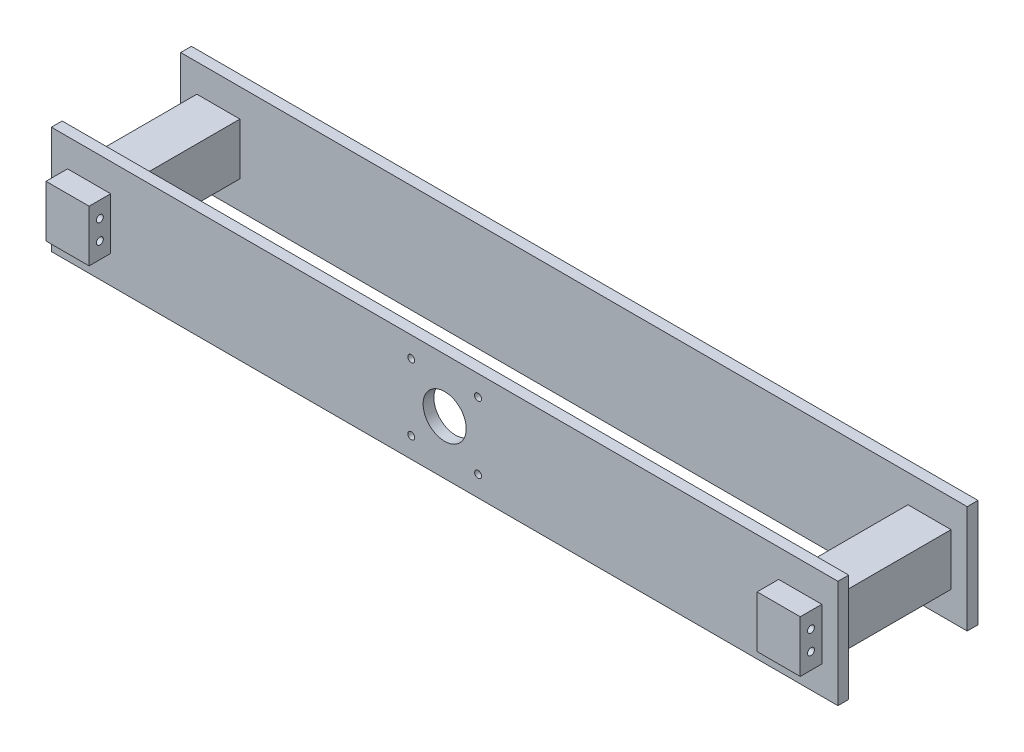
from build123d import *

# Parameters (mm, degrees)
SKETCH_1_W             = 365
SKETCH_1_H             = 50
EXTRUDE_1_DEPTH        = 2.5
SKETCH_2_W             = 20
SKETCH_2_H             = 24
EXTRUDE_2_DEPTH        = 70
PATTERN_LINEAR_1_COUNT = 2
PATTERN_LINEAR_1_PITCH = 60
SKETCH_4_R             = 1.6
CUT_EXTRUDE_1_DEPTH    = 366.633012733
CUT_EXTRUDE_2_REACH    = 197.336
SKETCH_5_R             = 1.6
SKETCH_5_R_2           = 10


with BuildPart() as part:
    # 草图1 → 凸台-拉伸1 (new, symmetric)
    with BuildSketch(Plane.XY):
        Rectangle(SKETCH_1_W, SKETCH_1_H)
    extrude_1 = extrude(amount=EXTRUDE_1_DEPTH, both=True)

    # 草图2 → 凸台-拉伸2 (add)
    with BuildSketch(Plane.XY.offset(2.5)):
        with Locations((165, 0)):
            Rectangle(SKETCH_2_W, SKETCH_2_H)
        with Locations((-165, 0)):
            Rectangle(SKETCH_2_W, SKETCH_2_H)
    extrude(amount=EXTRUDE_2_DEPTH)

    # 阵列(线性)1: 凸台-拉伸1 ×2
    with Locations(*[(0, 0, i * PATTERN_LINEAR_1_PITCH) for i in range(1, PATTERN_LINEAR_1_COUNT)]):
        add(extrude_1)

    # 草图4 → 切除-拉伸1 (cut, through all)
    with BuildSketch(Plane.ZY.offset(175)):
        with Locations((67.5, 4.5)):
            Circle(SKETCH_4_R)
    cut_extrude_1 = extrude(amount=-CUT_EXTRUDE_1_DEPTH, mode=Mode.SUBTRACT)

    # 草图5 → 切除-拉伸2 (cut, up to next)
    with BuildSketch(Plane.XY.offset(62.5), mode=Mode.PRIVATE) as cut_extrude_2_sk1:
        with Locations((-15.5, 15.5)):
            Circle(SKETCH_5_R)
    cut_extrude_2_tool1 = extrude(cut_extrude_2_sk1.sketch, amount=-CUT_EXTRUDE_2_REACH, mode=Mode.PRIVATE) & part.part
    # 草图5 → 切除-拉伸2 (cut, up to next)
    with BuildSketch(Plane.XY.offset(62.5), mode=Mode.PRIVATE) as cut_extrude_2_sk2:
        with Locations((15.5, 15.5)):
            Circle(SKETCH_5_R)
    cut_extrude_2_tool2 = extrude(cut_extrude_2_sk2.sketch, amount=-CUT_EXTRUDE_2_REACH, mode=Mode.PRIVATE) & part.part
    # 草图5 → 切除-拉伸2 (cut, up to next)
    with BuildSketch(Plane.XY.offset(62.5), mode=Mode.PRIVATE) as cut_extrude_2_sk3:
        with Locations((15.5, -15.5)):
            Circle(SKETCH_5_R)
    cut_extrude_2_tool3 = extrude(cut_extrude_2_sk3.sketch, amount=-CUT_EXTRUDE_2_REACH, mode=Mode.PRIVATE) & part.part
    # 草图5 → 切除-拉伸2 (cut, up to next)
    with BuildSketch(Plane.XY.offset(62.5), mode=Mode.PRIVATE) as cut_extrude_2_sk4:
        with Locations((-15.5, -15.5)):
            Circle(SKETCH_5_R)
    cut_extrude_2_tool4 = extrude(cut_extrude_2_sk4.sketch, amount=-CUT_EXTRUDE_2_REACH, mode=Mode.PRIVATE) & part.part
    # 草图5 → 切除-拉伸2 (cut, up to next)
    with BuildSketch(Plane.XY.offset(62.5), mode=Mode.PRIVATE) as cut_extrude_2_sk5:
        Circle(SKETCH_5_R_2)
    cut_extrude_2_tool5 = extrude(cut_extrude_2_sk5.sketch, amount=-CUT_EXTRUDE_2_REACH, mode=Mode.PRIVATE) & part.part
    add(cut_extrude_2_tool1.solids().sort_by_distance((-15.5, 15.5, 62.5))[0], mode=Mode.SUBTRACT)
    add(cut_extrude_2_tool2.solids().sort_by_distance((15.5, 15.5, 62.5))[0], mode=Mode.SUBTRACT)
    add(cut_extrude_2_tool3.solids().sort_by_distance((15.5, -15.5, 62.5))[0], mode=Mode.SUBTRACT)
    add(cut_extrude_2_tool4.solids().sort_by_distance((-15.5, -15.5, 62.5))[0], mode=Mode.SUBTRACT)
    add(cut_extrude_2_tool5.solids().sort_by_distance((0, 0, 62.5))[0], mode=Mode.SUBTRACT)

    # 镜向1: 切除-拉伸1 across plane
    add(cut_extrude_1.mirror(Plane.ZX), mode=Mode.SUBTRACT)


solid = part.part
